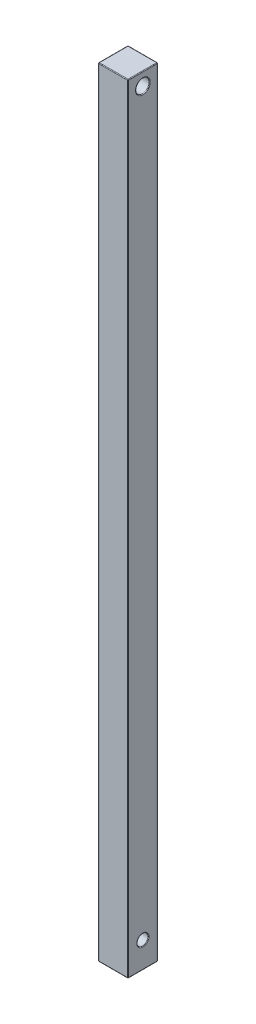
from build123d import *

# Parameters (mm, degrees)
SKETCH1_W           = 23
SKETCH1_H           = 23
BOSS_EXTRUDE1_DEPTH = 600
SKETCH2_R           = 4.25
CUT_EXTRUDE1_DEPTH  = 350
SKETCH3_R           = 5.25
CUT_EXTRUDE2_DEPTH  = 49
FILLET1_R           = 0.5


with BuildPart() as part:
    # Sketch1 → Boss-Extrude1 (new body)
    with BuildSketch(Plane(origin=(0, 0, 0), x_dir=(1, 0, 0), z_dir=(0, 1, 0))):
        with Locations((11.5, 11.5)):
            Rectangle(SKETCH1_W, SKETCH1_H)
    extrude(amount=BOSS_EXTRUDE1_DEPTH)

    # Sketch2 → Cut-Extrude1 (cut)
    with BuildSketch(Plane(origin=(23, 0, 0), x_dir=(0, 0, -1), z_dir=(1, 0, 0))):
        with Locations((11.5, 20)):
            Circle(SKETCH2_R)
    extrude(amount=-CUT_EXTRUDE1_DEPTH, mode=Mode.SUBTRACT)

    # Sketch3 → Cut-Extrude2 (cut)
    with BuildSketch(Plane(origin=(23, 0, 0), x_dir=(0, 0, -1), z_dir=(1, 0, 0))):
        with Locations((11.5, 590)):
            Circle(SKETCH3_R)
    extrude(amount=-CUT_EXTRUDE2_DEPTH, mode=Mode.SUBTRACT)

    # Fillet1
    fillet1_edges = [part.edges().sort_by_distance(p)[0] for p in [
        (23, 600, -11.5),
        (11.5, 600, -23),
        (0, 20, -7.25),
        (23, 20, -7.25),
        (0, 590, -6.25),
        (23, 590, -6.25),
        (0, 600, -11.5),
        (11.5, 0, -23),
        (23, 0, -11.5),
        (11.5, 0, 0),
        (0, 0, -11.5),
        (11.5, 600, 0),
        (0, 300, -23),
        (23, 300, -23),
        (23, 300, 0),
        (0, 300, 0),
    ]]
    fillet(fillet1_edges, radius=FILLET1_R)


solid = part.part
